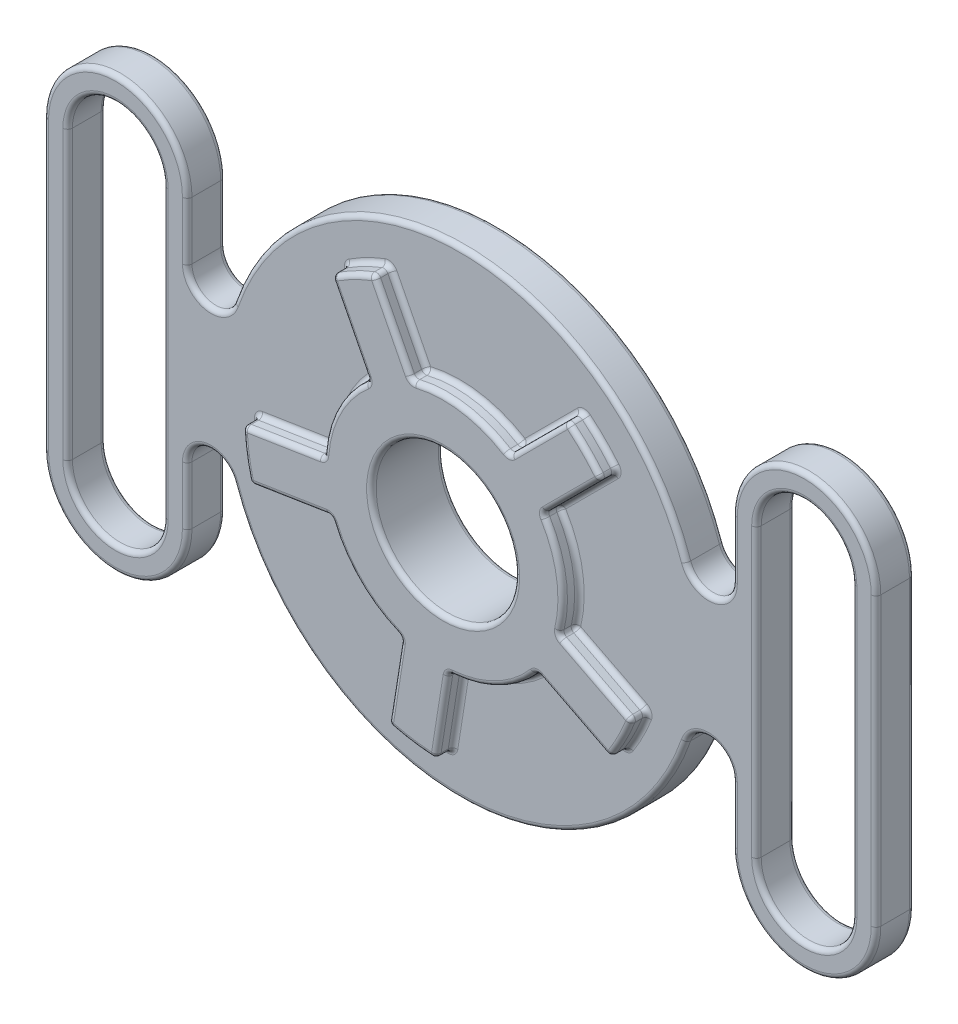
from build123d import *

# Parameters (mm, degrees)
SKETCH1_R           = 15
BOSS_EXTRUDE1_DEPTH = 7.5
BOSS_EXTRUDE2_DEPTH = 4
FILLET2_R           = 1


with BuildPart() as part:
    # Sketch1 → Boss-Extrude1 (new, symmetric)
    with BuildSketch(Plane.XY):
        with BuildLine():
            Line((25.932545143, 33.037904025), (13.764319975, 20.869678857))
            ThreePointArc((13.764319975, 20.869678857), (3.910861626, 24.692208515), (-6.641560771, 24.101652859))
            Line((-6.641560771, 24.101652859), (-14.45404224, 39.434511065))
            ThreePointArc((-14.45404224, 39.434511065), (-19.067600989, 37.422274016), (-23.407316751, 34.872589845))
            Line((-23.407316751, 34.872589845), (-15.594835282, 19.539731639))
            ThreePointArc((-15.594835282, 19.539731639), (-22.275163105, 11.349762493), (-24.974389152, 1.131320676))
            Line((-24.974389152, 1.131320676), (-41.970993405, -1.560676976))
            ThreePointArc((-41.970993405, -1.560676976), (-41.482910305, -6.570247532), (-40.399062481, -11.485458225))
            Line((-40.399062481, -11.485458225), (-23.402458229, -8.793460573))
            ThreePointArc((-23.402458229, -8.793460573), (-17.67766953, -17.67766953), (-8.793460573, -23.402458229))
            Line((-8.793460573, -23.402458229), (-11.485458225, -40.399062481))
            ThreePointArc((-11.485458225, -40.399062481), (-6.570247532, -41.482910305), (-1.560676976, -41.970993405))
            Line((-1.560676976, -41.970993405), (1.131320676, -24.974389152))
            ThreePointArc((1.131320676, -24.974389152), (11.349762493, -22.275163105), (19.539731639, -15.594835282))
            Line((19.539731639, -15.594835282), (34.872589845, -23.407316751))
            ThreePointArc((34.872589845, -23.407316751), (37.422274016, -19.067600989), (39.434511065, -14.45404224))
            Line((39.434511065, -14.45404224), (24.101652859, -6.641560771))
            ThreePointArc((24.101652859, -6.641560771), (24.692208515, 3.910861626), (20.869678857, 13.764319975))
            Line((20.869678857, 13.764319975), (33.037904025, 25.932545143))
            ThreePointArc((33.037904025, 25.932545143), (29.69848481, 29.69848481), (25.932545143, 33.037904025))
        make_face()
        Circle(SKETCH1_R, mode=Mode.SUBTRACT)
    extrude(amount=BOSS_EXTRUDE1_DEPTH, both=True)

    # Sketch1<3> → Boss-Extrude2 (add, symmetric)
    with BuildSketch(Plane.XY):
        with BuildLine():
            Line((-57, 17.916472867), (-57, 30))
            ThreePointArc((-57, 30), (-72, 45), (-87, 30))
            Line((-87, 30), (-87, -30))
            ThreePointArc((-87, -30), (-72, -45), (-57, -30))
            Line((-57, -30), (-57, -17.916472867))
            ThreePointArc((-57, -17.916472867), (-52.825722824, -12.985126011), (-47.272727273, -16.287702607))
            ThreePointArc((-47.272727273, -16.287702607), (0, -50), (47.272727273, -16.287702607))
            ThreePointArc((47.272727273, -16.287702607), (52.825722824, -12.985126011), (57, -17.916472867))
            Line((57, -17.916472867), (57, -30))
            ThreePointArc((57, -30), (72, -45), (87, -30))
            Line((87, -30), (87, 30))
            ThreePointArc((87, 30), (72, 45), (57, 30))
            Line((57, 30), (57, 17.916472867))
            ThreePointArc((57, 17.916472867), (52.825722824, 12.985126011), (47.272727273, 16.287702607))
            ThreePointArc((47.272727273, 16.287702607), (0, 50), (-47.272727273, 16.287702607))
            ThreePointArc((-47.272727273, 16.287702607), (-52.825722824, 12.985126011), (-57, 17.916472867))
        make_face()
        with BuildLine():
            ThreePointArc((-6.641560771, 24.101652859), (3.910861626, 24.692208515), (13.764319975, 20.869678857))
            Line((13.764319975, 20.869678857), (25.932545143, 33.037904025))
            ThreePointArc((25.932545143, 33.037904025), (29.69848481, 29.69848481), (33.037904025, 25.932545143))
            Line((33.037904025, 25.932545143), (20.869678857, 13.764319975))
            ThreePointArc((20.869678857, 13.764319975), (24.692208515, 3.910861626), (24.101652859, -6.641560771))
            Line((24.101652859, -6.641560771), (39.434511065, -14.45404224))
            ThreePointArc((39.434511065, -14.45404224), (37.422274016, -19.067600989), (34.872589845, -23.407316751))
            Line((34.872589845, -23.407316751), (19.539731639, -15.594835282))
            ThreePointArc((19.539731639, -15.594835282), (11.349762493, -22.275163105), (1.131320676, -24.974389152))
            Line((1.131320676, -24.974389152), (-1.560676976, -41.970993405))
            ThreePointArc((-1.560676976, -41.970993405), (-6.570247532, -41.482910305), (-11.485458225, -40.399062481))
            Line((-11.485458225, -40.399062481), (-8.793460573, -23.402458229))
            ThreePointArc((-8.793460573, -23.402458229), (-17.67766953, -17.67766953), (-23.402458229, -8.793460573))
            Line((-23.402458229, -8.793460573), (-40.399062481, -11.485458225))
            ThreePointArc((-40.399062481, -11.485458225), (-41.482910305, -6.570247532), (-41.970993405, -1.560676976))
            Line((-41.970993405, -1.560676976), (-24.974389152, 1.131320676))
            ThreePointArc((-24.974389152, 1.131320676), (-22.275163105, 11.349762493), (-15.594835282, 19.539731639))
            Line((-15.594835282, 19.539731639), (-23.407316751, 34.872589845))
            ThreePointArc((-23.407316751, 34.872589845), (-19.067600989, 37.422274016), (-14.45404224, 39.434511065))
            Line((-14.45404224, 39.434511065), (-6.641560771, 24.101652859))
        make_face(mode=Mode.SUBTRACT)
        with BuildLine():
            ThreePointArc((-82, 30), (-72, 40), (-62, 30))
            Line((-62, 30), (-62, -30))
            ThreePointArc((-62, -30), (-72, -40), (-82, -30))
            Line((-82, -30), (-82, 30))
        make_face(mode=Mode.SUBTRACT)
        with BuildLine():
            Line((62, -30), (62, 30))
            ThreePointArc((62, 30), (72, 40), (82, 30))
            Line((82, 30), (82, -30))
            ThreePointArc((82, -30), (72, -40), (62, -30))
        make_face(mode=Mode.SUBTRACT)
    extrude(amount=BOSS_EXTRUDE2_DEPTH, both=True)

    # Fillet2
    fillet2_edges = [part.edges().sort_by_distance(p)[0] for p in [
        (34.872589845, -23.407316751, 5.75),
        (34.872589845, -23.407316751, -5.75),
        (39.434511065, -14.45404224, 5.75),
        (39.434511065, -14.45404224, -5.75),
        (24.101652859, -6.641560771, 5.75),
        (24.101652859, -6.641560771, -5.75),
        (20.869678857, 13.764319975, 5.75),
        (20.869678857, 13.764319975, -5.75),
        (33.037904025, 25.932545143, 5.75),
        (33.037904025, 25.932545143, -5.75),
        (25.932545143, 33.037904025, 5.75),
        (25.932545143, 33.037904025, -5.75),
        (13.764319975, 20.869678857, 5.75),
        (13.764319975, 20.869678857, -5.75),
        (-6.641560771, 24.101652859, 5.75),
        (-6.641560771, 24.101652859, -5.75),
        (-14.45404224, 39.434511065, 5.75),
        (-14.45404224, 39.434511065, -5.75),
        (-23.407316751, 34.872589845, 5.75),
        (-23.407316751, 34.872589845, -5.75),
        (-15.594835282, 19.539731639, 5.75),
        (-15.594835282, 19.539731639, -5.75),
        (-24.974389152, 1.131320676, 5.75),
        (-24.974389152, 1.131320676, -5.75),
        (-41.970993405, -1.560676976, 5.75),
        (-41.970993405, -1.560676976, -5.75),
        (-40.399062481, -11.485458225, 5.75),
        (-40.399062481, -11.485458225, -5.75),
        (-23.402458229, -8.793460573, 5.75),
        (-23.402458229, -8.793460573, -5.75),
        (-8.793460573, -23.402458229, 5.75),
        (-8.793460573, -23.402458229, -5.75),
        (-11.485458225, -40.399062481, 5.75),
        (-11.485458225, -40.399062481, -5.75),
        (-1.560676976, -41.970993405, 5.75),
        (-1.560676976, -41.970993405, -5.75),
        (1.131320676, -24.974389152, 5.75),
        (1.131320676, -24.974389152, -5.75),
        (19.539731639, -15.594835282, 5.75),
        (19.539731639, -15.594835282, -5.75),
        (11.349762493, -22.275163105, 7.5),
        (-0.21467815, -33.472691278, 7.5),
        (-6.570247532, -41.482910305, 7.5),
        (-10.139459399, -31.900760355, 7.5),
        (-17.67766953, -17.67766953, 7.5),
        (-31.900760355, -10.139459399, 7.5),
        (-41.482910305, -6.570247532, 7.5),
        (-33.472691278, -0.21467815, 7.5),
        (-22.275163105, 11.349762493, 7.5),
        (-19.501076017, 27.206160742, 7.5),
        (-19.067600989, 37.422274016, 7.5),
        (-10.547801506, 31.768081962, 7.5),
        (3.910861626, 24.692208515, 7.5),
        (19.848432559, 26.953791441, 7.5),
        (29.69848481, 29.69848481, 7.5),
        (26.953791441, 19.848432559, 7.5),
        (24.692208515, 3.910861626, 7.5),
        (31.768081962, -10.547801506, 7.5),
        (37.422274016, -19.067600989, 7.5),
        (27.206160742, -19.501076017, 7.5),
        (-15, 0, 7.5),
        (11.349762493, -22.275163105, -7.5),
        (-0.21467815, -33.472691278, -7.5),
        (-6.570247532, -41.482910305, -7.5),
        (-10.139459399, -31.900760355, -7.5),
        (-17.67766953, -17.67766953, -7.5),
        (-31.900760355, -10.139459399, -7.5),
        (-41.482910305, -6.570247532, -7.5),
        (-33.472691278, -0.21467815, -7.5),
        (-22.275163105, 11.349762493, -7.5),
        (-19.501076017, 27.206160742, -7.5),
        (-19.067600989, 37.422274016, -7.5),
        (-10.547801506, 31.768081962, -7.5),
        (3.910861626, 24.692208515, -7.5),
        (19.848432559, 26.953791441, -7.5),
        (29.69848481, 29.69848481, -7.5),
        (26.953791441, 19.848432559, -7.5),
        (24.692208515, 3.910861626, -7.5),
        (31.768081962, -10.547801506, -7.5),
        (37.422274016, -19.067600989, -7.5),
        (27.206160742, -19.501076017, -7.5),
        (-15, 0, -7.5),
        (57, 23.958236434, 4),
        (72, 45, 4),
        (87, 0, 4),
        (72, -45, 4),
        (57, -23.958236434, 4),
        (52.825722824, -12.985126011, 4),
        (0, -50, 4),
        (-52.825722824, -12.985126011, 4),
        (-57, -23.958236434, 4),
        (-72, -45, 4),
        (-87, 0, 4),
        (-72, 45, 4),
        (-57, 23.958236434, 4),
        (-52.825722824, 12.985126011, 4),
        (0, 50, 4),
        (52.825722824, 12.985126011, 4),
        (-62, 0, 4),
        (-72, 40, 4),
        (-82, 0, 4),
        (-72, -40, 4),
        (31.768081962, -10.547801506, 4),
        (24.692208515, 3.910861626, 4),
        (26.953791441, 19.848432559, 4),
        (29.69848481, 29.69848481, 4),
        (19.848432559, 26.953791441, 4),
        (3.910861626, 24.692208515, 4),
        (-10.547801506, 31.768081962, 4),
        (-19.067600989, 37.422274016, 4),
        (-19.501076017, 27.206160742, 4),
        (-22.275163105, 11.349762493, 4),
        (-33.472691278, -0.21467815, 4),
        (-41.482910305, -6.570247532, 4),
        (-31.900760355, -10.139459399, 4),
        (-17.67766953, -17.67766953, 4),
        (-10.139459399, -31.900760355, 4),
        (-6.570247532, -41.482910305, 4),
        (-0.21467815, -33.472691278, 4),
        (11.349762493, -22.275163105, 4),
        (27.206160742, -19.501076017, 4),
        (37.422274016, -19.067600989, 4),
        (72, 40, 4),
        (62, 0, 4),
        (72, -40, 4),
        (82, 0, 4),
        (57, 23.958236434, -4),
        (72, 45, -4),
        (87, 0, -4),
        (72, -45, -4),
        (57, -23.958236434, -4),
        (52.825722824, -12.985126011, -4),
        (0, -50, -4),
        (-52.825722824, -12.985126011, -4),
        (-57, -23.958236434, -4),
        (-72, -45, -4),
        (-87, 0, -4),
        (-72, 45, -4),
        (-57, 23.958236434, -4),
        (-52.825722824, 12.985126011, -4),
        (0, 50, -4),
        (52.825722824, 12.985126011, -4),
        (-62, 0, -4),
        (-72, 40, -4),
        (-82, 0, -4),
        (-72, -40, -4),
        (31.768081962, -10.547801506, -4),
        (24.692208515, 3.910861626, -4),
        (26.953791441, 19.848432559, -4),
        (29.69848481, 29.69848481, -4),
        (19.848432559, 26.953791441, -4),
        (3.910861626, 24.692208515, -4),
        (-10.547801506, 31.768081962, -4),
        (-19.067600989, 37.422274016, -4),
        (-19.501076017, 27.206160742, -4),
        (-22.275163105, 11.349762493, -4),
        (-33.472691278, -0.21467815, -4),
        (-41.482910305, -6.570247532, -4),
        (-31.900760355, -10.139459399, -4),
        (-17.67766953, -17.67766953, -4),
        (-10.139459399, -31.900760355, -4),
        (-6.570247532, -41.482910305, -4),
        (-0.21467815, -33.472691278, -4),
        (11.349762493, -22.275163105, -4),
        (27.206160742, -19.501076017, -4),
        (37.422274016, -19.067600989, -4),
        (72, 40, -4),
        (62, 0, -4),
        (72, -40, -4),
        (82, 0, -4),
    ]]
    fillet(fillet2_edges, radius=FILLET2_R)


solid = part.part
